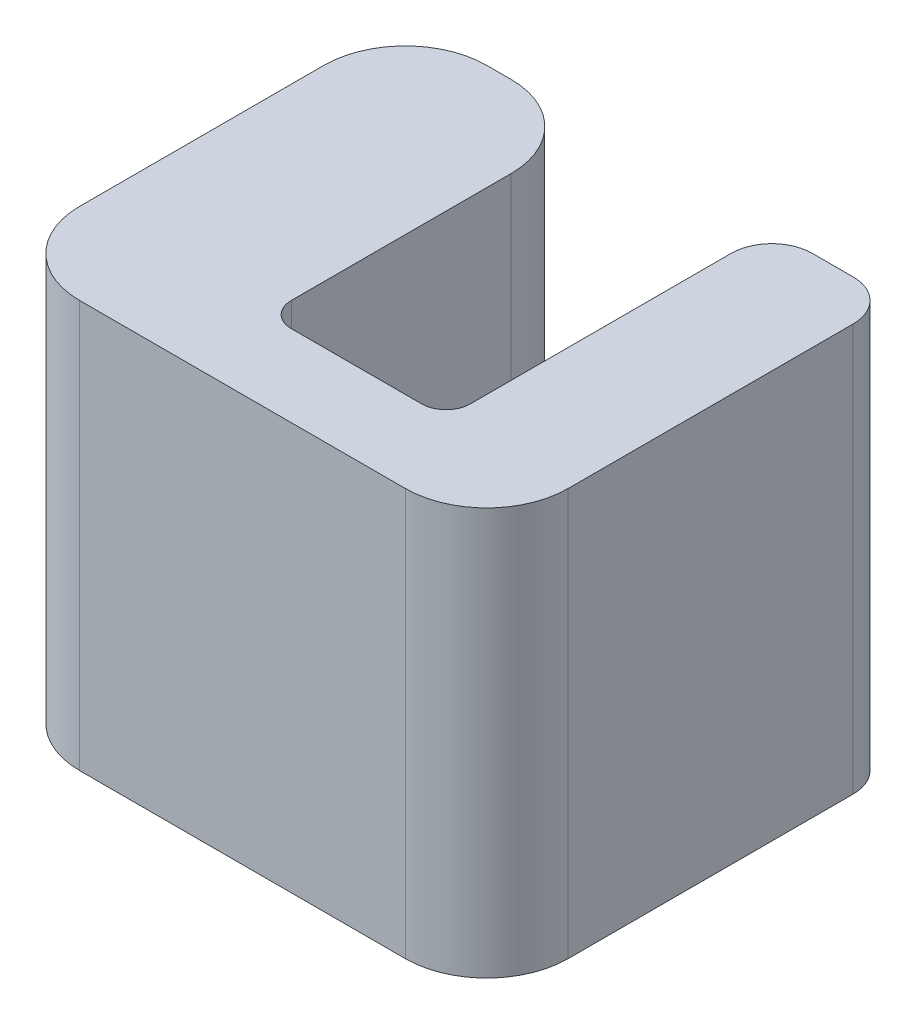
from build123d import *

# Parameters (mm, degrees)
ESBO_O1_W                = 6
ESBO_O1_H                = 5
RESSALTO_EXTRUS_O1_DEPTH = 5
ESBO_O3_W                = 2.2
ESBO_O3_H                = 4
CORTE_EXTRUS_O1_DEPTH    = 5
FILETE1_R                = 1
FILETE2_R                = 1
FILETE3_R                = 1
FILETE4_R                = 1
FILETE5_R                = 0.5
FILETE6_R                = 0.5
FILETE7_R                = 0.3
FILETE8_R                = 0.3


with BuildPart() as part:
    # Esboço1 → Ressalto-extrusão1 (new body)
    with BuildSketch(Plane(origin=(0, 0, 0), x_dir=(1, 0, 0), z_dir=(0, 1, 0))):
        Rectangle(ESBO_O1_W, ESBO_O1_H)
    extrude(amount=RESSALTO_EXTRUS_O1_DEPTH)

    # Esboço3 → Corte-extrusão1 (cut)
    with BuildSketch(Plane(origin=(0, 5, 0), x_dir=(1, 0, 0), z_dir=(0, 1, 0))):
        with Locations((0.4, 0.5)):
            Rectangle(ESBO_O3_W, ESBO_O3_H)
    extrude(amount=-CORTE_EXTRUS_O1_DEPTH, mode=Mode.SUBTRACT)

    # Filete1
    filete1_edges = [part.edges().sort_by_distance(p)[0] for p in [
        (3, 2.5, 2.5),
    ]]
    fillet(filete1_edges, radius=FILETE1_R)

    # Filete2
    filete2_edges = [part.edges().sort_by_distance(p)[0] for p in [
        (-3, 2.5, 2.5),
    ]]
    fillet(filete2_edges, radius=FILETE2_R)

    # Filete3
    filete3_edges = [part.edges().sort_by_distance(p)[0] for p in [
        (-3, 2.5, -2.5),
    ]]
    fillet(filete3_edges, radius=FILETE3_R)

    # Filete4
    filete4_edges = [part.edges().sort_by_distance(p)[0] for p in [
        (-0.7, 2.5, -2.5),
    ]]
    fillet(filete4_edges, radius=FILETE4_R)

    # Filete5
    filete5_edges = [part.edges().sort_by_distance(p)[0] for p in [
        (1.5, 2.5, -2.5),
    ]]
    fillet(filete5_edges, radius=FILETE5_R)

    # Filete6
    filete6_edges = [part.edges().sort_by_distance(p)[0] for p in [
        (3, 2.5, -2.5),
    ]]
    fillet(filete6_edges, radius=FILETE6_R)

    # Filete7
    filete7_edges = [part.edges().sort_by_distance(p)[0] for p in [
        (1.5, 2.5, 1.5),
    ]]
    fillet(filete7_edges, radius=FILETE7_R)

    # Filete8
    filete8_edges = [part.edges().sort_by_distance(p)[0] for p in [
        (-0.7, 2.5, 1.5),
    ]]
    fillet(filete8_edges, radius=FILETE8_R)


solid = part.part
